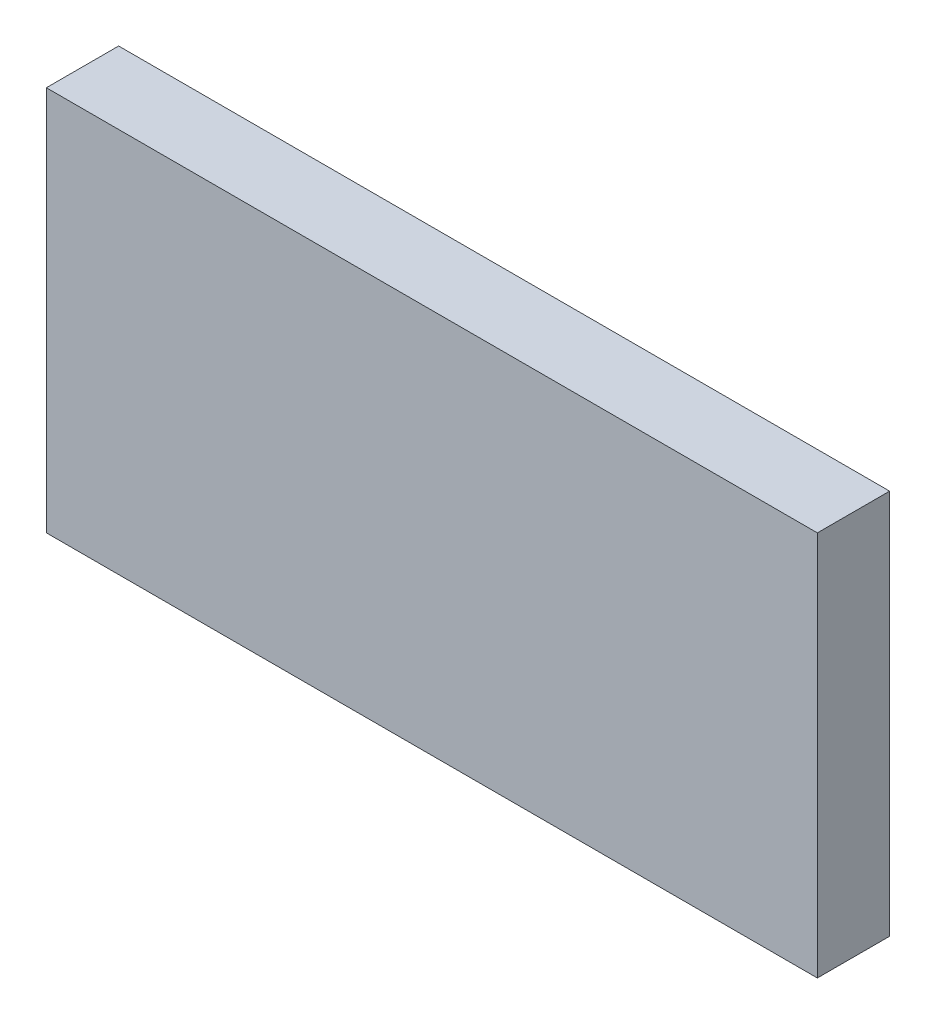
from build123d import *

# Parameters (mm, degrees)
SKETCH1_W           = 160
SKETCH1_H           = 80
BOSS_EXTRUDE1_DEPTH = 15


with BuildPart() as part:
    # Sketch1 → Boss-Extrude1 (new body)
    with BuildSketch(Plane.XY):
        Rectangle(SKETCH1_W, SKETCH1_H)
    extrude(amount=BOSS_EXTRUDE1_DEPTH)


solid = part.part
